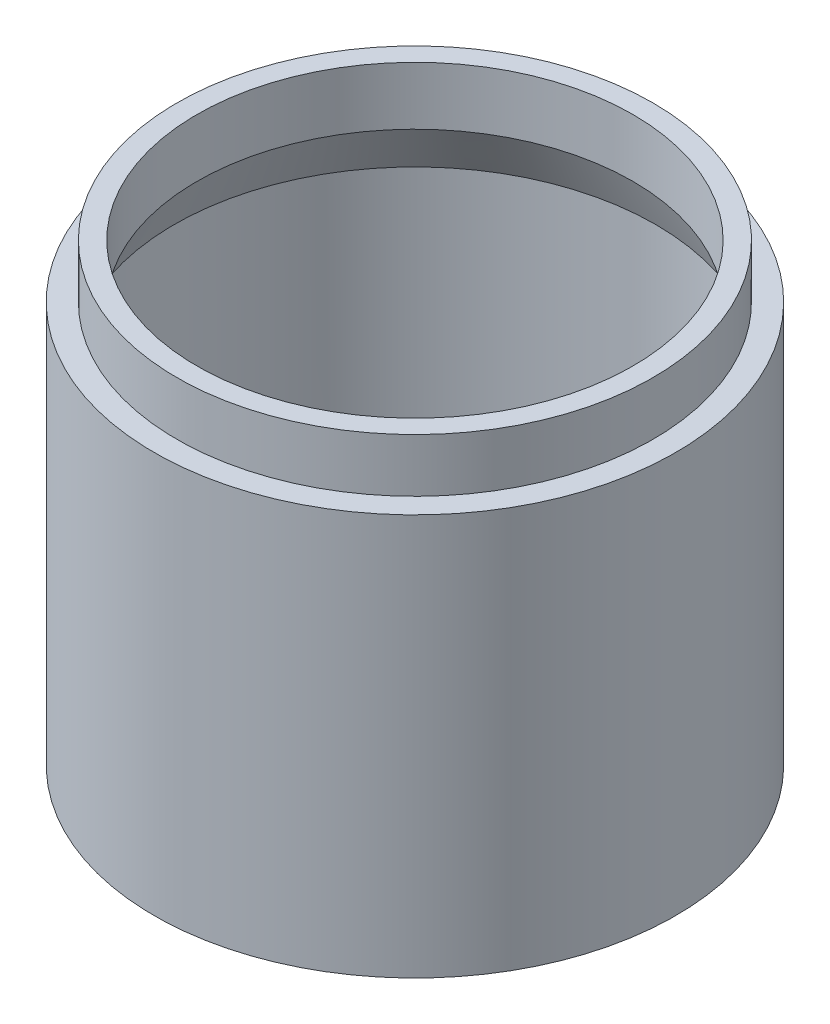
from build123d import *

# Parameters (mm, degrees)
BOSS_EXTRUDE1_REACH                  = 105.503
BOSS_EXTRUDE1_END_RADIUS             = 45.72
BOSS_EXTRUDE1_DIRECTION_2_REACH      = 105.503
BOSS_EXTRUDE1_DIRECTION_2_END_RADIUS = 45.72
EXTRUDE_THIN1_START                  = -2.54
SKETCH3_R                            = 45.72
SKETCH3_R_2                          = 26.67
EXTRUDE_THIN1_DEPTH                  = 2.54


with BuildPart() as part:
    # Sketch1 → Revolve1 (revolve)
    with BuildSketch(Plane(origin=(0, 0, 0), x_dir=(0, 0, -1), z_dir=(1, 0, 0)), mode=Mode.PRIVATE) as revolve1_sk:
        Polygon((-49.53, 0), (-49.53, -76.2), (-45.72, -76.2), (-45.72, -10.104637547), (-41.402, -0.844656665), (-41.402, 10.16), (-45.212, 10.16), (-45.212, 0), align=None)
    revolve(revolve1_sk.sketch.rotate(Axis((0, 0, 0), (0, 1, 0)), 180), axis=Axis((0, 0, 0), (0, 1, 0)))

    # Boss-Extrude1: up to this cylinder (the profile starts inside it)
    boss_extrude1_end = Plane(origin=(0, -73.102853, 0), z_dir=(0, -1, 0)) * Cylinder(BOSS_EXTRUDE1_END_RADIUS, 303.446, mode=Mode.PRIVATE)
    # Sketch2 → Boss-Extrude1 (add, up to the surface)
    with BuildSketch(Plane(origin=(0, 0, 0), x_dir=(0, 0, -1), z_dir=(1, 0, 0)), mode=Mode.PRIVATE) as boss_extrude1_sk1:
        with BuildLine():
            Line((4.445, -73.66), (4.445, -76.2))
            Line((4.445, -76.2), (-4.445, -76.2))
            Line((-4.445, -76.2), (-4.445, -73.66))
            ThreePointArc((-4.445, -73.66), (0, -69.215), (4.445, -73.66))
        make_face()
    boss_extrude1_tool1 = extrude(boss_extrude1_sk1.sketch, amount=BOSS_EXTRUDE1_REACH, mode=Mode.PRIVATE) & boss_extrude1_end
    add(boss_extrude1_tool1.solids().sort_by_distance((0, -73.102853, 0))[0])

    # Boss-Extrude1 direction 2: up to this cylinder (the profile starts inside it)
    boss_extrude1_direction_2_end = Plane(origin=(0, -73.102853, 0), z_dir=(0, -1, 0)) * Cylinder(BOSS_EXTRUDE1_DIRECTION_2_END_RADIUS, 303.446, mode=Mode.PRIVATE)
    # Sketch2 → Boss-Extrude1 direction 2 (add, up to the surface)
    with BuildSketch(Plane(origin=(0, 0, 0), x_dir=(0, 0, -1), z_dir=(1, 0, 0)), mode=Mode.PRIVATE) as boss_extrude1_direction_2_sk1:
        with BuildLine():
            Line((4.445, -73.66), (4.445, -76.2))
            Line((4.445, -76.2), (-4.445, -76.2))
            Line((-4.445, -76.2), (-4.445, -73.66))
            ThreePointArc((-4.445, -73.66), (0, -69.215), (4.445, -73.66))
        make_face()
    boss_extrude1_direction_2_tool1 = extrude(boss_extrude1_direction_2_sk1.sketch, amount=-BOSS_EXTRUDE1_DIRECTION_2_REACH, mode=Mode.PRIVATE) & boss_extrude1_direction_2_end
    add(boss_extrude1_direction_2_tool1.solids().sort_by_distance((0, -73.102853, 0))[0])

    # Sketch3 → Extrude-Thin1 (add)
    with BuildSketch(Plane.XZ.offset(76.2).offset(EXTRUDE_THIN1_START)):
        Circle(SKETCH3_R)
        Circle(SKETCH3_R_2, mode=Mode.SUBTRACT)
    extrude(amount=EXTRUDE_THIN1_DEPTH)


solid = part.part
